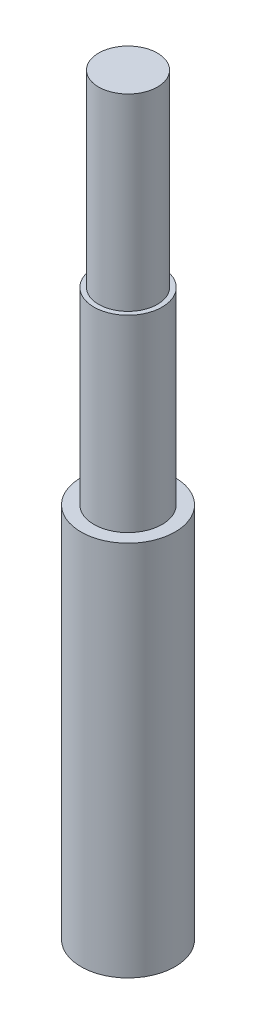
from build123d import *

# Parameters (mm, degrees)
SKETCH1_R           = 3.175
BOSS_EXTRUDE1_DEPTH = 38.1
SKETCH2_R           = 3.591307694
SKETCH2_R_2         = 2.3
CUT_EXTRUDE1_DEPTH  = 12.7
SKETCH3_R           = 1.984375
BOSS_EXTRUDE2_DEPTH = 12.7


with BuildPart() as part:
    # Sketch1 → Boss-Extrude1 (new body)
    with BuildSketch(Plane(origin=(0, 0, 0), x_dir=(1, 0, 0), z_dir=(0, 1, 0))):
        with Locations(Location((0, 0, 0), (0, 0, 90))):
            Circle(SKETCH1_R)
    extrude(amount=BOSS_EXTRUDE1_DEPTH)

    # Sketch2 → Cut-Extrude1 (cut)
    with BuildSketch(Plane(origin=(0, 38.1, 0), x_dir=(1, 0, 0), z_dir=(0, 1, 0))):
        Circle(SKETCH2_R)
        with Locations(Location((0, 0, 0), (0, 0, 270))):
            Circle(SKETCH2_R_2, mode=Mode.SUBTRACT)
    extrude(amount=-CUT_EXTRUDE1_DEPTH, mode=Mode.SUBTRACT)

    # Sketch3 → Boss-Extrude2 (add)
    with BuildSketch(Plane(origin=(0, 38.1, 0), x_dir=(1, 0, 0), z_dir=(0, 1, 0))):
        with Locations(Location((0, 0, 0), (0, 0, 270))):
            Circle(SKETCH3_R)
    extrude(amount=BOSS_EXTRUDE2_DEPTH)


solid = part.part
